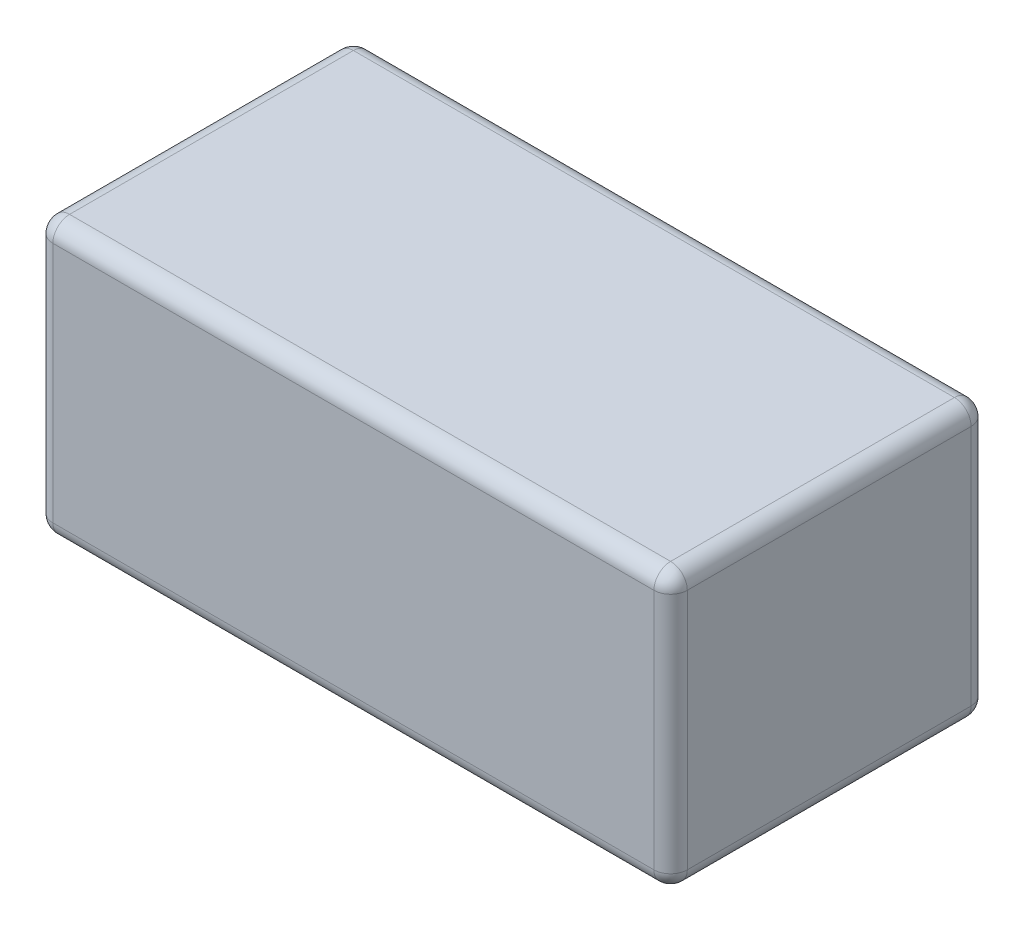
from build123d import *

# Parameters (mm, degrees)
SKETCH1_W           = 76
SKETCH1_H           = 38
BOSS_EXTRUDE1_DEPTH = 33
FILLET1_R           = 2


with BuildPart() as part:
    # Sketch1 → Boss-Extrude1 (new body)
    with BuildSketch(Plane(origin=(0, 0, 0), x_dir=(1, 0, 0), z_dir=(0, 1, 0))):
        Rectangle(SKETCH1_W, SKETCH1_H)
    extrude(amount=BOSS_EXTRUDE1_DEPTH)

    # Fillet1
    fillet1_edges = [part.edges().sort_by_distance(p)[0] for p in [
        (-38, 33, 0),
        (0, 33, 19),
        (38, 33, 0),
        (0, 0, 19),
        (-38, 0, 0),
        (0, 0, -19),
        (38, 0, 0),
        (38, 16.5, 19),
        (-38, 16.5, 19),
        (-38, 16.5, -19),
        (38, 16.5, -19),
        (0, 33, -19),
    ]]
    fillet(fillet1_edges, radius=FILLET1_R)


solid = part.part
